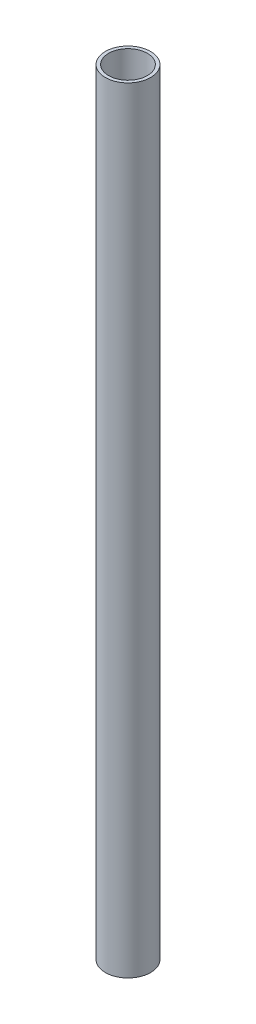
from build123d import *

# Parameters (mm, degrees)
SKETCH1_R           = 3.5
SKETCH1_R_2         = 3
BOSS_EXTRUDE1_DEPTH = 60


with BuildPart() as part:
    # Sketch1 → Boss-Extrude1 (new, symmetric)
    with BuildSketch(Plane(origin=(0, 0, 0), x_dir=(1, 0, 0), z_dir=(0, 1, 0))):
        with Locations(Location((0, 0, 0), (0, 0, 270))):
            Circle(SKETCH1_R)
        with Locations(Location((0, 0, 0), (0, 0, 270))):
            Circle(SKETCH1_R_2, mode=Mode.SUBTRACT)
    extrude(amount=BOSS_EXTRUDE1_DEPTH, both=True)


solid = part.part
